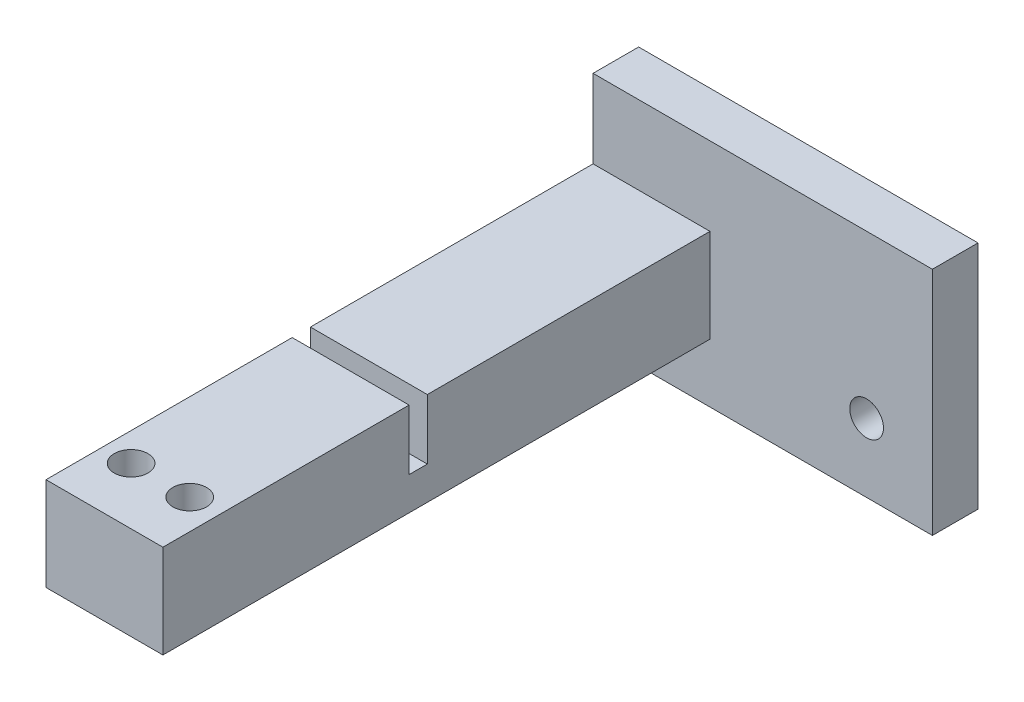
from build123d import *

# Parameters (mm, degrees)
CROQUIS2_W              = 37.219606625
CROQUIS2_H              = 25.289645753
SALIENTE_EXTRUIR1_DEPTH = 5
CROQUIS3_W              = 12.822792139
CROQUIS3_H              = 10.241869911
SALIENTE_EXTRUIR2_DEPTH = 60
CROQUIS4_W              = 2
CROQUIS4_H              = 6.778219121
CORTAR_EXTRUIR1_DEPTH   = 60
CORTAR_EXTRUIR2_REACH   = 263.618
CROQUIS5_R              = 1.85
CROQUIS6_R              = 1.85
CORTAR_EXTRUIR3_DEPTH   = 74.340748192


with BuildPart() as part:
    # Croquis2 → Saliente-Extruir1 (new body)
    with BuildSketch(Plane.XY):
        with Locations((10.975865795, -240.275746154)):
            Rectangle(CROQUIS2_W, CROQUIS2_H)
    extrude(amount=SALIENTE_EXTRUIR1_DEPTH)

    # Croquis3 → Saliente-Extruir2 (add)
    with BuildSketch(Plane.XY.offset(5)):
        with Locations((-1.222541449, -241.35158101)):
            Rectangle(CROQUIS3_W, CROQUIS3_H)
    extrude(amount=SALIENTE_EXTRUIR2_DEPTH)

    # Croquis4 → Cortar-Extruir1 (cut)
    with BuildSketch(Plane.ZY.offset(7.633937518)):
        with Locations((37, -239.446035793)):
            Rectangle(CROQUIS4_W, CROQUIS4_H)
    extrude(amount=-CORTAR_EXTRUIR1_DEPTH, mode=Mode.SUBTRACT)

    # Croquis5 → Cortar-Extruir2 (cut, up to next)
    with BuildSketch(Plane.XY.offset(5), mode=Mode.PRIVATE) as cortar_extruir2_sk1:
        with Locations((-2.795177489, -249.862416258)):
            Circle(CROQUIS5_R)
    cortar_extruir2_tool1 = extrude(cortar_extruir2_sk1.sketch, amount=-CORTAR_EXTRUIR2_REACH, mode=Mode.PRIVATE) & part.part
    # Croquis5 → Cortar-Extruir2 (cut, up to next)
    with BuildSketch(Plane.XY.offset(5), mode=Mode.PRIVATE) as cortar_extruir2_sk2:
        with Locations((22.369152578, -245.40207204)):
            Circle(CROQUIS5_R)
    cortar_extruir2_tool2 = extrude(cortar_extruir2_sk2.sketch, amount=-CORTAR_EXTRUIR2_REACH, mode=Mode.PRIVATE) & part.part
    add(cortar_extruir2_tool1.solids().sort_by_distance((-2.795177, -249.862416, 5))[0], mode=Mode.SUBTRACT)
    add(cortar_extruir2_tool2.solids().sort_by_distance((22.369153, -245.402072, 5))[0], mode=Mode.SUBTRACT)

    # Croquis6 → Cortar-Extruir3 (cut, through all)
    with BuildSketch(Plane(origin=(0, -236.230646054, 0), x_dir=(1, 0, 0), z_dir=(0, 1, 0))):
        with Locations(Location((1.905498405, -58.778240746, 0), (0, 0, 270))):
            Circle(CROQUIS6_R)
        with Locations(Location((-4.523066348, -58.778240746, 0), (0, 0, 270))):
            Circle(CROQUIS6_R)
    extrude(amount=-CORTAR_EXTRUIR3_DEPTH, mode=Mode.SUBTRACT)


solid = part.part
